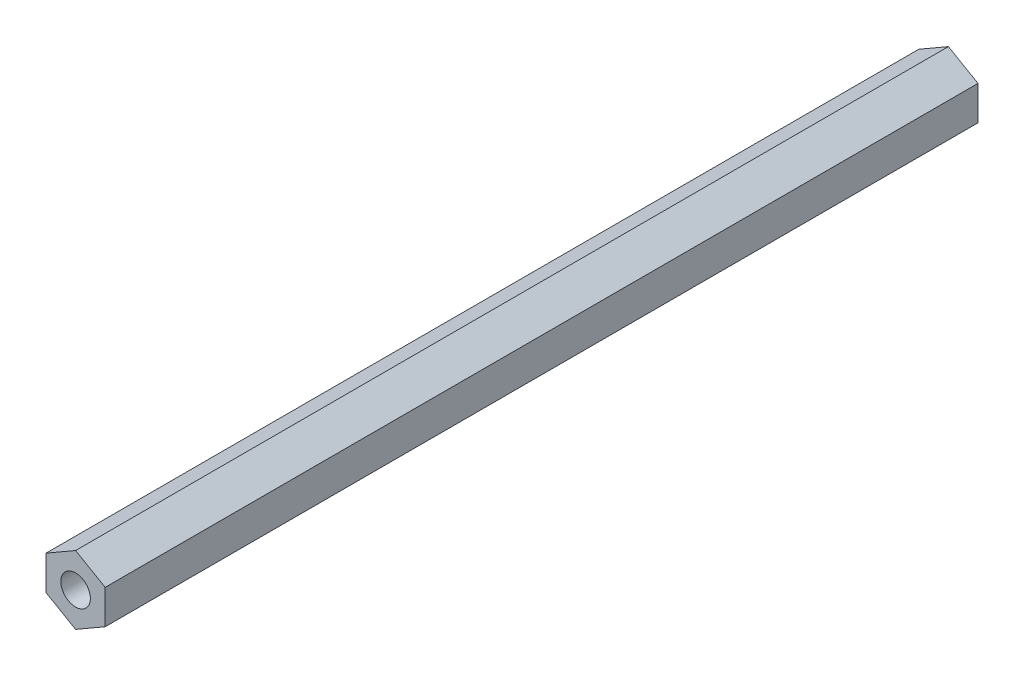
from build123d import *

# Parameters (mm, degrees)
SKETCH1_R           = 3.175
BOSS_EXTRUDE1_DEPTH = 187.325


with BuildPart() as part:
    # Sketch1 → Boss-Extrude1 (new body)
    with BuildSketch(Plane.XY):
        Polygon((0, 7.332348419), (-6.35, 3.666174209), (-6.35, -3.666174209), (0, -7.332348419), (6.35, -3.666174209), (6.35, 3.666174209), align=None)
        with Locations(Location((0, 0, 0), (0, 0, 180))):
            Circle(SKETCH1_R, mode=Mode.SUBTRACT)
    extrude(amount=BOSS_EXTRUDE1_DEPTH)


solid = part.part
